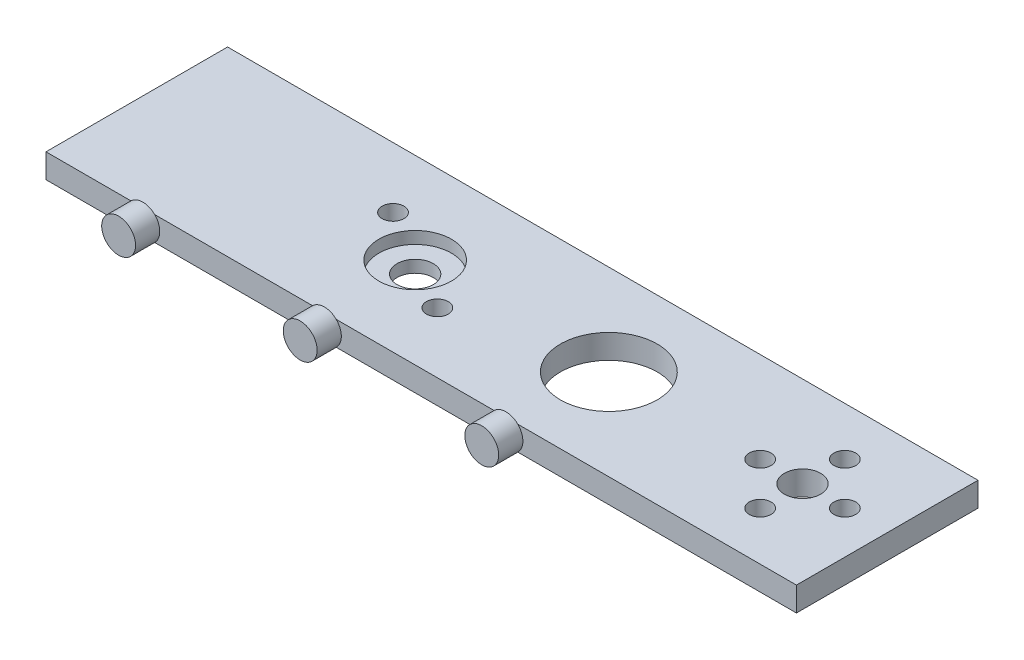
from build123d import *

# Parameters (mm, degrees)
SKETCH_1_W          = 62
SKETCH_1_H          = 15
SKETCH_1_R          = 0.9
SKETCH_1_R_2        = 1.5
SKETCH_1_R_3        = 4
EXTRUDE_1_DEPTH     = 2
SKETCH_2_R          = 1.4
EXTRUDE_2_DEPTH     = 2
SKETCH_4_R          = 3
CUT_EXTRUDE_1_DEPTH = 1


with BuildPart() as part:
    # 草图1 → 凸台-拉伸1 (new body)
    # profile 1 of 3: a face of its own
    with BuildSketch(Plane(origin=(0, 0, 0), x_dir=(1, 0, 0), z_dir=(0, 1, 0))):
        Rectangle(SKETCH_1_W, SKETCH_1_H)
        with Locations(Location((-12.330127019, 2.5, 0), (0, 0, 270))):
            Circle(SKETCH_1_R, mode=Mode.SUBTRACT)
        with Locations(Location((24, 3.5, 0), (0, 0, 270))):
            Circle(SKETCH_1_R, mode=Mode.SUBTRACT)
        with Locations(Location((20.5, 0, 0), (0, 0, 270))):
            Circle(SKETCH_1_R, mode=Mode.SUBTRACT)
        with Locations(Location((24, -3.5, 0), (0, 0, 270))):
            Circle(SKETCH_1_R, mode=Mode.SUBTRACT)
        with Locations(Location((27.5, 0, 0), (0, 0, 270))):
            Circle(SKETCH_1_R, mode=Mode.SUBTRACT)
        with Locations(Location((24, 0, 0), (0, 0, 270))):
            Circle(SKETCH_1_R_2, mode=Mode.SUBTRACT)
        with Locations(Location((8, 0, 0), (0, 0, 270))):
            Circle(SKETCH_1_R_3, mode=Mode.SUBTRACT)
        with Locations((-12.330127019, -2.5)):
            Circle(SKETCH_1_R, mode=Mode.SUBTRACT)
        with Locations((-3.669872981, 2.5)):
            Circle(SKETCH_1_R, mode=Mode.SUBTRACT)
        with Locations(Location((-8, 0, 0), (0, 0, 270))):
            Circle(SKETCH_1_R_2, mode=Mode.SUBTRACT)
        with Locations(Location((-3.669872981, -2.5, 0), (0, 0, 270))):
            Circle(SKETCH_1_R, mode=Mode.SUBTRACT)
    # profile 2 of 3: a face of its own
    with BuildSketch(Plane(origin=(0, 0, 0), x_dir=(1, 0, 0), z_dir=(0, 1, 0))):
        with Locations((-12.330127019, -2.5)):
            Circle(SKETCH_1_R)
    # profile 3 of 3: a face of its own
    with BuildSketch(Plane(origin=(0, 0, 0), x_dir=(1, 0, 0), z_dir=(0, 1, 0))):
        with Locations((-3.669872981, 2.5)):
            Circle(SKETCH_1_R)
    extrude(amount=EXTRUDE_1_DEPTH)

    # 草图2 → 凸台-拉伸2 (add)
    with BuildSketch(Plane.XY.offset(7.5)):
        with Locations(Location((-23, 1, 0), (0, 0, 134.415308597))):
            Circle(SKETCH_2_R)
        with Locations(Location((-8, 1, 0), (0, 0, 134.415308597))):
            Circle(SKETCH_2_R)
        with Locations(Location((7, 1, 0), (0, 0, 134.415308597))):
            Circle(SKETCH_2_R)
    extrude(amount=EXTRUDE_2_DEPTH)

    # 草图4 → 切除-拉伸1 (cut)
    with BuildSketch(Plane(origin=(0, 2, 0), x_dir=(1, 0, 0), z_dir=(0, 1, 0))):
        with Locations(Location((-8, 0, 0), (0, 0, 270))):
            Circle(SKETCH_4_R)
    extrude(amount=-CUT_EXTRUDE_1_DEPTH, mode=Mode.SUBTRACT)


solid = part.part
